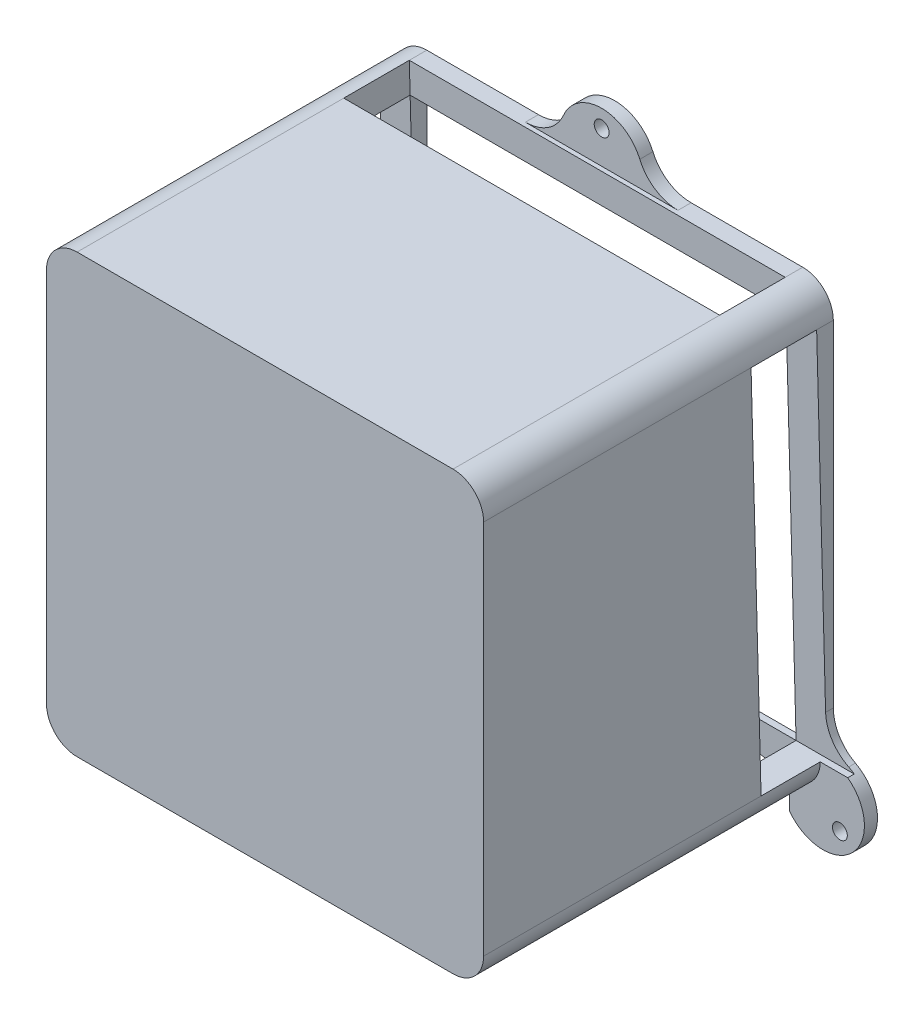
from build123d import *

# Parameters (mm, degrees)
ESQUISSE1_W                           = 100
ESQUISSE1_H                           = 100
BOSS_EXTRU_1_DEPTH                    = 80
ESQUISSE2_W                           = 86
ESQUISSE2_H                           = 86
ENL_V_MAT_EXTRU_1_DEPTH               = 70
ESQUISSE4_R                           = 9.5
ESQUISSE4_R_2                         = 1.5
BOSS_EXTRU_3_DEPTH                    = 3
CONG_1_R                              = 7
CONG_4_R                              = 9.5
D_GAGEMENT_M31_D                      = 3.4
D_GAGEMENT_M31_DEPTH                  = 3
ENL_V_MAT_EXTRU_2_REACH               = 184.154
ENL_V_MAT_EXTRU_2_OFFSET_FROM_SURFACE = 7
ESQUISSE8_W                           = 86
ESQUISSE8_H                           = 15
ENL_V_START                           = -13.296333
ENL_V_MAT_EXTRU_3_DEPTH               = 112.592666


with BuildPart() as part:
    # Esquisse1 → Boss.-Extru.1 (new body)
    with BuildSketch(Plane.XY):
        with Locations((50, 50)):
            Rectangle(ESQUISSE1_W, ESQUISSE1_H)
    extrude(amount=BOSS_EXTRU_1_DEPTH)

    # Esquisse2 → Enlèv. mat.-Extru.1 (cut)
    with BuildSketch(Plane(origin=(0, 0, 0), x_dir=(-1, 0, 0), z_dir=(0, 0, -1))):
        with Locations((-50, 50)):
            Rectangle(ESQUISSE2_W, ESQUISSE2_H)
    extrude(amount=-ENL_V_MAT_EXTRU_1_DEPTH, mode=Mode.SUBTRACT)

    # Esquisse4 → Boss.-Extru.3 (add)
    # profile 1 of 3: a face of its own
    with BuildSketch(Plane(origin=(0, 0, 0), x_dir=(-1, 0, 0), z_dir=(0, 0, -1))):
        with Locations((0.610912703, -0.610912703)):
            Circle(ESQUISSE4_R)
        with Locations((4.5, -4.5)):
            Circle(ESQUISSE4_R_2, mode=Mode.SUBTRACT)
    # profile 2 of 3: a face of its own
    with BuildSketch(Plane(origin=(0, 0, 0), x_dir=(-1, 0, 0), z_dir=(0, 0, -1))):
        with Locations((-100.610912703, -0.610912703)):
            Circle(ESQUISSE4_R)
        with Locations((-104.5, -4.5)):
            Circle(ESQUISSE4_R_2, mode=Mode.SUBTRACT)
    # profile 3 of 3: a face of its own
    with BuildSketch(Plane(origin=(0, 0, 0), x_dir=(-1, 0, 0), z_dir=(0, 0, -1))):
        with BuildLine():
            Line((-46.958618735, 93), (-53.041381265, 93))
            ThreePointArc((-53.041381265, 93), (-50, 111.5), (-46.958618735, 93))
        make_face()
        with Locations((-50, 107.5)):
            Circle(ESQUISSE4_R_2, mode=Mode.SUBTRACT)
    extrude(amount=-BOSS_EXTRU_3_DEPTH)

    # Congé1
    cong_1_edges = [part.edges().sort_by_distance(p)[0] for p in [
        (0, 100, 40),
        (100, 100, 40),
        (100, 0, 41.5),
        (0, 0, 41.5),
    ]]
    fillet(cong_1_edges, radius=CONG_1_R)

    # Congé4
    cong_4_edges = [part.edges().sort_by_distance(p)[0] for p in [
        (91.130575913, 0, 1.5),
        (100, 8.869424087, 1.5),
        (0, 8.869424087, 1.5),
        (8.869424087, 0, 1.5),
        (40.712912189, 100, 1.5),
        (59.287087811, 100, 1.5),
    ]]
    fillet(cong_4_edges, radius=CONG_4_R)

    # Dégagement M31
    with Locations(Plane.XY.offset(3)):
        with Locations((104.5, -4.5), (-4.5, -4.5), (50, 107.5)):
            Hole(D_GAGEMENT_M31_D / 2, depth=D_GAGEMENT_M31_DEPTH)

    # Enlèv. mat.-Extru.2: up to this face of the body (flat: up to its plane, moved by the offset)
    enl_v_mat_extru_2_end = Plane(part.part.faces().sort_by_distance((50, 0, 40.310761501))[0]).offset(ENL_V_MAT_EXTRU_2_OFFSET_FROM_SURFACE)
    # Esquisse8 → Enlèv. mat.-Extru.2 (cut, up to the picked face)
    with BuildSketch(Plane(origin=(0, 102.060853814, 2.721755672), x_dir=(1, 0, 0), z_dir=(0, 0.9996445992724862, 0.026658491055395153)), mode=Mode.PRIVATE) as enl_v_mat_extru_2_sk1:
        with Locations((50, -8.834150894)):
            Rectangle(ESQUISSE8_W, ESQUISSE8_H)
    enl_v_mat_extru_2_tool1 = split(extrude(enl_v_mat_extru_2_sk1.sketch, amount=-ENL_V_MAT_EXTRU_2_REACH, mode=Mode.PRIVATE), bisect_by=enl_v_mat_extru_2_end, keep=Keep.BOTH, mode=Mode.PRIVATE)
    add(enl_v_mat_extru_2_tool1.solids().sort_by(Axis((50, 101.825349, 11.552767), (0, -0.9996445992724862, -0.026658491055395153)))[0], mode=Mode.SUBTRACT)

    # Esquisse9 → Enlèv. mat.-Extru.3 (cut)
    with BuildSketch(Plane.ZY.offset(-93).offset(ENL_V_START)):
        Polygon((18.820079232, 93), (16.52663391, 7), (1.521301003, 7), (3.814746326, 93), align=None)
    extrude(amount=ENL_V_MAT_EXTRU_3_DEPTH, mode=Mode.SUBTRACT)


solid = part.part
